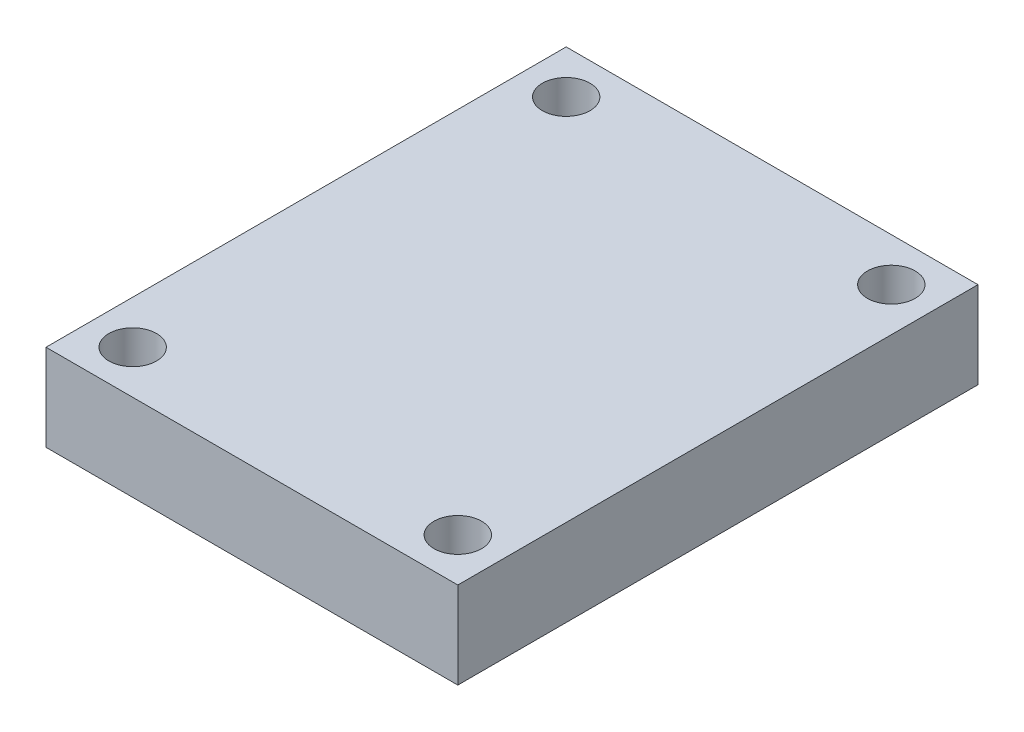
from build123d import *

# Parameters (mm, degrees)
ESQUISSE1_R        = 2.2
BOSS_EXTRU_1_DEPTH = 8


with BuildPart() as part:
    # Esquisse1 → Boss.-Extru.1 (new body)
    with BuildSketch(Plane(origin=(0, 0, 0), x_dir=(1, 0, 0), z_dir=(0, 1, 0))):
        Polygon((0, 0), (0, 48), (-8, 48), (-38, 48), (-38, 0), (-30, 0), (-8, 0), align=None)
        with Locations(Location((-4, 4, 0), (0, 0, 270))):
            Circle(ESQUISSE1_R, mode=Mode.SUBTRACT)
        with Locations(Location((-4, 44, 0), (0, 0, 270))):
            Circle(ESQUISSE1_R, mode=Mode.SUBTRACT)
        with Locations(Location((-34, 4, 0), (0, 0, 270))):
            Circle(ESQUISSE1_R, mode=Mode.SUBTRACT)
        with Locations(Location((-34, 44, 0), (0, 0, 270))):
            Circle(ESQUISSE1_R, mode=Mode.SUBTRACT)
    extrude(amount=BOSS_EXTRU_1_DEPTH)


solid = part.part
